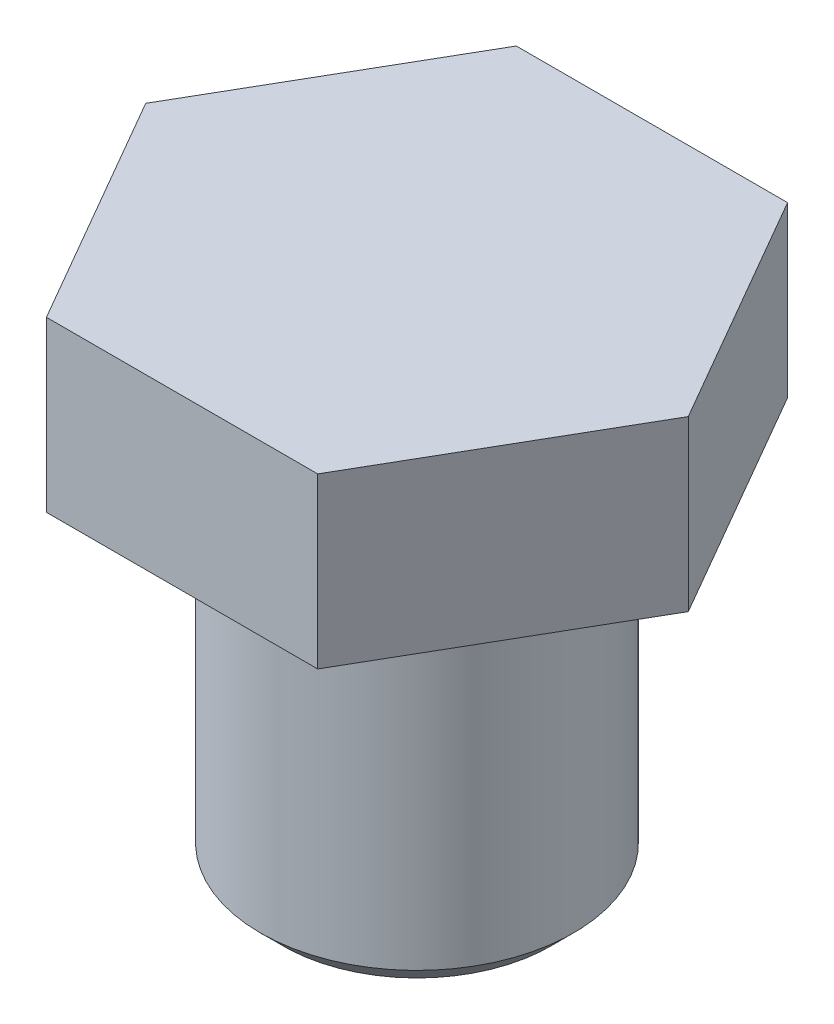
from build123d import *

# Parameters (mm, degrees)
BOSS_EXTRUDE1_DEPTH = 7.55
SKETCH2_R           = 7
BOSS_EXTRUDE2_DEPTH = 16
CHAMFER1_SIZE       = 1


with BuildPart() as part:
    # Sketch1 → Boss-Extrude1 (new body)
    with BuildSketch(Plane(origin=(0, 0, 0), x_dir=(1, 0, 0), z_dir=(0, 1, 0))):
        Polygon((-12.124355653, 0), (-6.062177826, -10.5), (6.062177826, -10.5), (12.124355653, 0), (6.062177826, 10.5), (-6.062177826, 10.5), align=None)
    extrude(amount=BOSS_EXTRUDE1_DEPTH)

    # Sketch2 → Boss-Extrude2 (add)
    with BuildSketch(Plane.XZ):
        with Locations(Location((0, 0, 0), (0, 0, 270))):
            Circle(SKETCH2_R)
    extrude(amount=BOSS_EXTRUDE2_DEPTH)

    # Chamfer1
    chamfer1_edges = [part.edges().sort_by_distance(p)[0] for p in [
        (0, -16, 7),
    ]]
    chamfer(chamfer1_edges, length=CHAMFER1_SIZE)


solid = part.part
